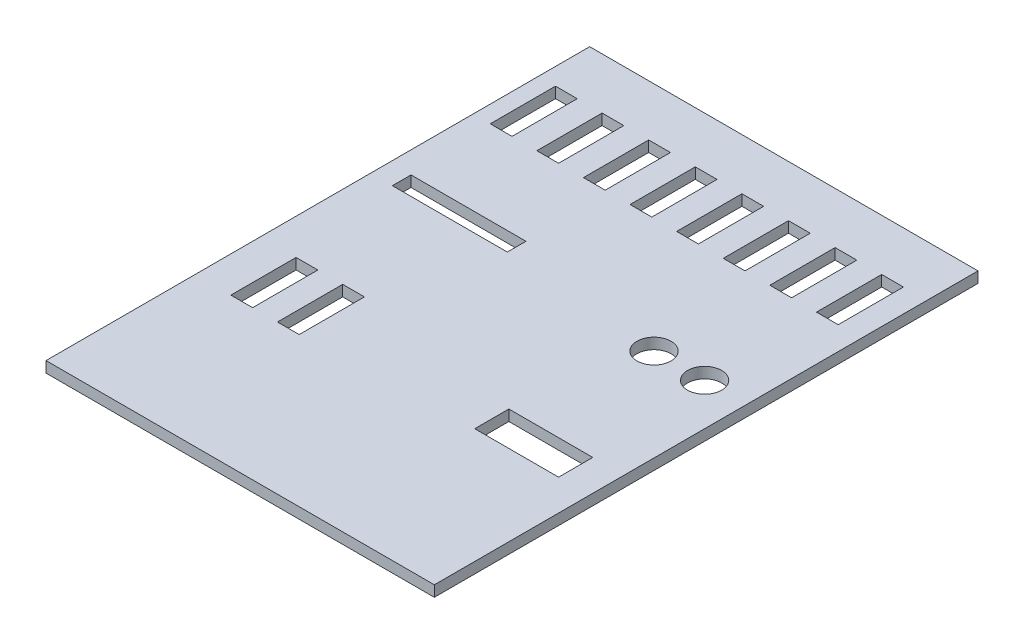
from build123d import *

# Parameters (mm, degrees)
SKETCH1_W           = 250
SKETCH1_H           = 350
BOSS_EXTRUDE1_DEPTH = 7
SKETCH2_W           = 14
SKETCH2_H           = 42
CUT_EXTRUDE1_DEPTH  = 281.478441071
SKETCH3_W           = 14
SKETCH3_H           = 42
CUT_EXTRUDE2_DEPTH  = 281.478441071
SKETCH4_W           = 74
SKETCH4_H           = 12
CUT_EXTRUDE3_DEPTH  = 281.478441071
SKETCH5_W           = 54
SKETCH5_H           = 22
CUT_EXTRUDE4_DEPTH  = 281.478441071
SKETCH6_R           = 11
CUT_EXTRUDE5_DEPTH  = 281.478441071


with BuildPart() as part:
    # Sketch1 → Boss-Extrude1 (new body)
    with BuildSketch(Plane(origin=(0, 0, 0), x_dir=(1, 0, 0), z_dir=(0, 1, 0))):
        with Locations((2.912621359, -74.514563107)):
            Rectangle(SKETCH1_W, SKETCH1_H)
    extrude(amount=BOSS_EXTRUDE1_DEPTH)

    # Sketch2 → Cut-Extrude1 (cut, through all)
    with BuildSketch(Plane(origin=(0, 7, 0), x_dir=(1, 0, 0), z_dir=(0, 1, 0))):
        with Locations((-104.087378641, 46.485436893)):
            Rectangle(SKETCH2_W, SKETCH2_H)
        with Locations((-74.087378641, 46.485436893)):
            Rectangle(SKETCH2_W, SKETCH2_H)
        with Locations((-44.087378641, 46.485436893)):
            Rectangle(SKETCH2_W, SKETCH2_H)
        with Locations((-14.087378641, 46.485436893)):
            Rectangle(SKETCH2_W, SKETCH2_H)
        with Locations((15.912621359, 46.485436893)):
            Rectangle(SKETCH2_W, SKETCH2_H)
        with Locations((45.912621359, 46.485436893)):
            Rectangle(SKETCH2_W, SKETCH2_H)
        with Locations((75.912621359, 46.485436893)):
            Rectangle(SKETCH2_W, SKETCH2_H)
        with Locations((105.912621359, 46.485436893)):
            Rectangle(SKETCH2_W, SKETCH2_H)
    extrude(amount=-CUT_EXTRUDE1_DEPTH, mode=Mode.SUBTRACT)

    # Sketch3 → Cut-Extrude2 (cut, through all)
    with BuildSketch(Plane(origin=(0, 7, 0), x_dir=(1, 0, 0), z_dir=(0, 1, 0))):
        with Locations((-92.087378641, -132.514563107)):
            Rectangle(SKETCH3_W, SKETCH3_H)
        with Locations((-62.087378641, -132.514563107)):
            Rectangle(SKETCH3_W, SKETCH3_H)
    extrude(amount=-CUT_EXTRUDE2_DEPTH, mode=Mode.SUBTRACT)

    # Sketch4 → Cut-Extrude3 (cut, through all)
    with BuildSketch(Plane(origin=(0, 7, 0), x_dir=(1, 0, 0), z_dir=(0, 1, 0))):
        with Locations((-71.087378641, -34.514563107)):
            Rectangle(SKETCH4_W, SKETCH4_H)
    extrude(amount=-CUT_EXTRUDE3_DEPTH, mode=Mode.SUBTRACT)

    # Sketch5 → Cut-Extrude4 (cut, through all)
    with BuildSketch(Plane(origin=(0, 7, 0), x_dir=(1, 0, 0), z_dir=(0, 1, 0))):
        with Locations((80.912621359, -138.514563107)):
            Rectangle(SKETCH5_W, SKETCH5_H)
    extrude(amount=-CUT_EXTRUDE4_DEPTH, mode=Mode.SUBTRACT)

    # Sketch6 → Cut-Extrude5 (cut, through all)
    with BuildSketch(Plane(origin=(0, 7, 0), x_dir=(1, 0, 0), z_dir=(0, 1, 0))):
        with Locations(Location((100.912621359, -48.514563107, 0), (0, 0, 270))):
            Circle(SKETCH6_R)
        with Locations(Location((68.333659496, -48.514563107, 0), (0, 0, 270))):
            Circle(SKETCH6_R)
    extrude(amount=-CUT_EXTRUDE5_DEPTH, mode=Mode.SUBTRACT)


solid = part.part
